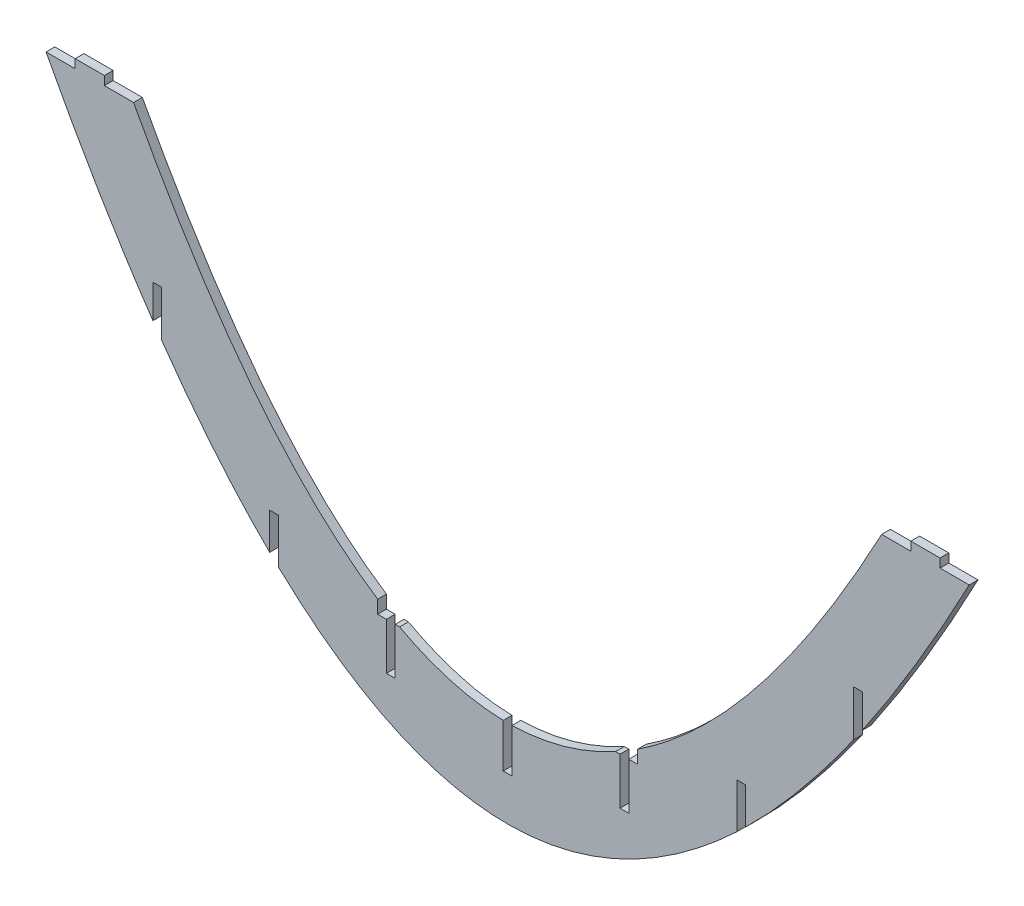
from build123d import *

# Parameters (mm, degrees)
EXTRUDE_1_DEPTH     = 3
EXTRUDE_2_DEPTH     = 3
SKETCH_3_W          = 3
SKETCH_3_H          = 16.032248228
CUT_EXTRUDE_1_DEPTH = 221.043181703


with BuildPart() as part:
    # 草图1 → 凸台-拉伸1 (new body)
    with BuildSketch(Plane.XY):
        with BuildLine():
            Line((-158.115, 150.002119351), (-128.116129222, 150.002119351))
            add(Edge.make_bspline(
                [(-128.116129222, 150.002119351), (0, -90.00211935), (128.116129222, 150.002119351)],
                knots=[0.138632221, 0.138632221, 0.138632221, 0.861367779, 0.861367779, 0.861367779], degree=2))
            Line((128.116129222, 150.002119351), (158.115, 150.002119351))
            add(Edge.make_bspline(
                [(-158.115, 150.002119351), (0, -150.002119351), (158.115, 150.002119351)],
                knots=[0.056807195, 0.056807195, 0.056807195, 0.943192805, 0.943192805, 0.943192805], degree=2))
        make_face()
    extrude(amount=EXTRUDE_1_DEPTH)

    # 草图2 → 凸台-拉伸2 (add)
    with BuildSketch(Plane(origin=(0, 150.002119351, 0), x_dir=(1, 0, 0), z_dir=(0, 1, 0))):
        Polygon((138.115564611, 0), (138.115564611, -0.999981179), (148.115564611, -2.000018821), (148.115564611, 0), align=None)
        Polygon((148.115564611, -2.000018821), (138.115564611, -0.999981179), (138.115564611, -3), (148.115564611, -3), align=None)
        Polygon((-148.115564611, 0), (-148.115564611, -2.000018821), (-138.115564611, -0.999981179), (-138.115564611, 0), align=None)
        Polygon((-138.115564611, -0.999981179), (-148.115564611, -2.000018821), (-148.115564611, -3), (-138.115564611, -3), align=None)
    extrude(amount=EXTRUDE_2_DEPTH)

    # 草图3 → 切除-拉伸1 (cut, through all)
    with BuildSketch(Plane(origin=(0, 0, 0), x_dir=(-1, 0, 0), z_dir=(0, 0, -1))):
        with BuildLine():
            Line((38.5, 47.194759053), (38.5, 40.836842401))
            add(Edge.make_bspline(
                [(41.5, 42.591500641), (40, 41.681271679), (38.5, 40.836842401)],
                knots=[0.382943991, 0.382943991, 0.382943991, 0.391405871, 0.391405871, 0.391405871], degree=2))
            Line((41.5, 42.591500641), (41.5, 47.194759053))
            Line((41.5, 47.194759053), (38.5, 47.194759053))
        make_face()
        with BuildLine():
            Line((41.5, 42.591500641), (41.5, 40.0008631))
            Line((41.5, 40.0008631), (44.5, 40.0008631))
            Line((44.5, 40.0008631), (44.5, 44.477758249))
            add(Edge.make_bspline(
                [(44.5, 44.477758249), (43, 43.501729603), (41.5, 42.591500641)],
                knots=[0.37448211, 0.37448211, 0.37448211, 0.382943991, 0.382943991, 0.382943991], degree=2))
        make_face()
        with BuildLine():
            Line((38.5, 40.836842401), (38.5, 40.0008631))
            Line((38.5, 40.0008631), (41.5, 40.0008631))
            Line((41.5, 40.0008631), (41.5, 42.591500641))
            add(Edge.make_bspline(
                [(41.5, 42.591500641), (40, 41.681271679), (38.5, 40.836842401)],
                knots=[0.382943991, 0.382943991, 0.382943991, 0.391405871, 0.391405871, 0.391405871], degree=2))
        make_face()
        with Locations((40, 31.984738986)):
            Rectangle(SKETCH_3_W, SKETCH_3_H)
        with BuildLine():
            add(Edge.make_bspline(
                [(38.5, 40.836842401), (37.742605127, 40.410464797), (36.985210253, 40.0008631)],
                knots=[0.391405871, 0.391405871, 0.391405871, 0.395678527, 0.395678527, 0.395678527], degree=2))
            Line((36.985210253, 40.0008631), (38.5, 40.0008631))
            Line((38.5, 40.0008631), (38.5, 40.836842401))
        make_face()
        with BuildLine():
            Line((-36.985210253, 40.0008631), (36.985210253, 40.0008631))
            add(Edge.make_bspline(
                [(38.5, 40.836842401), (37.742605127, 40.410464797), (36.985210253, 40.0008631)],
                knots=[0.391405871, 0.391405871, 0.391405871, 0.395678527, 0.395678527, 0.395678527], degree=2))
            Line((38.5, 40.836842401), (38.5, 47.194759053))
            Line((38.5, 47.194759053), (41.5, 47.194759053))
            Line((41.5, 47.194759053), (41.5, 42.591500641))
            add(Edge.make_bspline(
                [(44.5, 44.477758249), (43, 43.501729603), (41.5, 42.591500641)],
                knots=[0.37448211, 0.37448211, 0.37448211, 0.382943991, 0.382943991, 0.382943991], degree=2))
            Line((44.5, 44.477758249), (44.5, 80.0008631))
            Line((44.5, 80.0008631), (-44.5, 80.0008631))
            Line((-44.5, 80.0008631), (-44.5, 44.477758249))
            add(Edge.make_bspline(
                [(-40.274457726, 41.858798825), (-42.387228863, 43.103008147), (-44.5, 44.477758249)],
                knots=[0.613599212, 0.613599212, 0.613599212, 0.62551789, 0.62551789, 0.62551789], degree=2))
            Line((-40.274457726, 41.858798825), (-38.5, 41.858798825))
            Line((-38.5, 41.858798825), (-38.5, 40.836842401))
            add(Edge.make_bspline(
                [(-36.985210253, 40.0008631), (-37.742605127, 40.410464797), (-38.5, 40.836842401)],
                knots=[0.604321473, 0.604321473, 0.604321473, 0.608594129, 0.608594129, 0.608594129], degree=2))
        make_face()
        with BuildLine():
            Line((-38.5, 40.0008631), (-36.985210253, 40.0008631))
            add(Edge.make_bspline(
                [(-36.985210253, 40.0008631), (-37.742605127, 40.410464797), (-38.5, 40.836842401)],
                knots=[0.604321473, 0.604321473, 0.604321473, 0.608594129, 0.608594129, 0.608594129], degree=2))
            Line((-38.5, 40.836842401), (-38.5, 40.0008631))
        make_face()
        with BuildLine():
            add(Edge.make_bspline(
                [(-38.5, 40.836842401), (-39.387228863, 41.33631042), (-40.274457726, 41.858798825)],
                knots=[0.608594129, 0.608594129, 0.608594129, 0.613599212, 0.613599212, 0.613599212], degree=2))
            Line((-38.5, 40.836842401), (-38.5, 41.858798825))
            Line((-38.5, 41.858798825), (-40.274457726, 41.858798825))
        make_face()
        with BuildLine():
            Line((-41.5, 40.0008631), (-38.5, 40.0008631))
            Line((-38.5, 40.0008631), (-38.5, 40.836842401))
            add(Edge.make_bspline(
                [(-38.5, 40.836842401), (-39.387228863, 41.33631042), (-40.274457726, 41.858798825)],
                knots=[0.608594129, 0.608594129, 0.608594129, 0.613599212, 0.613599212, 0.613599212], degree=2))
            Line((-40.274457726, 41.858798825), (-41.5, 41.858798825))
            Line((-41.5, 41.858798825), (-41.5, 40.0008631))
        make_face()
        with BuildLine():
            Line((-44.5, 40.0008631), (-41.5, 40.0008631))
            Line((-41.5, 40.0008631), (-41.5, 41.858798825))
            Line((-41.5, 41.858798825), (-40.274457726, 41.858798825))
            add(Edge.make_bspline(
                [(-40.274457726, 41.858798825), (-42.387228863, 43.103008147), (-44.5, 44.477758249)],
                knots=[0.613599212, 0.613599212, 0.613599212, 0.62551789, 0.62551789, 0.62551789], degree=2))
            Line((-44.5, 44.477758249), (-44.5, 40.0008631))
        make_face()
        with Locations((-40, 31.984738986)):
            Rectangle(SKETCH_3_W, SKETCH_3_H)
        with BuildLine():
            Line((-1.5, 15.008656511), (1.5, 15.008656511))
            Line((1.5, 15.008656511), (1.5, 30.016449922))
            add(Edge.make_bspline(
                [(-1.5, 30.016449922), (0, 29.98355008), (1.5, 30.016449922)],
                knots=[0, 0, 0, 1, 1, 1], degree=2))
            Line((-1.5, 30.016449922), (-1.5, 15.008656511))
        make_face()
        with BuildLine():
            Line((-118.5, 84.2535), (-118.5, 99.99195986))
            Line((-118.5, 99.99195986), (-121.5, 99.99195986))
            Line((-121.5, 99.99195986), (-121.5, 88.5735))
            add(Edge.make_bspline(
                [(-121.5, 88.5735), (-120, 86.3865), (-118.5, 84.2535)],
                knots=[0.15943822, 0.15943822, 0.15943822, 0.167847153, 0.167847153, 0.167847153], degree=2))
        make_face()
        with BuildLine():
            Line((-81.5, 52.368455115), (-81.5, 39.8535))
            add(Edge.make_bspline(
                [(-81.5, 39.8535), (-80, 38.3865), (-78.5, 36.9735)],
                knots=[0.271557325, 0.271557325, 0.271557325, 0.279966258, 0.279966258, 0.279966258], degree=2))
            Line((-78.5, 36.9735), (-78.5, 52.368455115))
            Line((-78.5, 52.368455115), (-81.5, 52.368455115))
        make_face()
        with BuildLine():
            Line((78.5, 52.368455115), (78.5, 36.9735))
            add(Edge.make_bspline(
                [(78.5, 36.9735), (80, 38.3865), (81.5, 39.8535)],
                knots=[0.720033742, 0.720033742, 0.720033742, 0.728442675, 0.728442675, 0.728442675], degree=2))
            Line((81.5, 39.8535), (81.5, 52.368455115))
            Line((81.5, 52.368455115), (78.5, 52.368455115))
        make_face()
        with BuildLine():
            Line((118.5, 99.99195986), (118.5, 84.2535))
            add(Edge.make_bspline(
                [(118.5, 84.2535), (120, 86.3865), (121.5, 88.5735)],
                knots=[0.832152847, 0.832152847, 0.832152847, 0.84056178, 0.84056178, 0.84056178], degree=2))
            Line((121.5, 88.5735), (121.5, 99.99195986))
            Line((121.5, 99.99195986), (118.5, 99.99195986))
        make_face()
    extrude(amount=-CUT_EXTRUDE_1_DEPTH, mode=Mode.SUBTRACT)


solid = part.part
